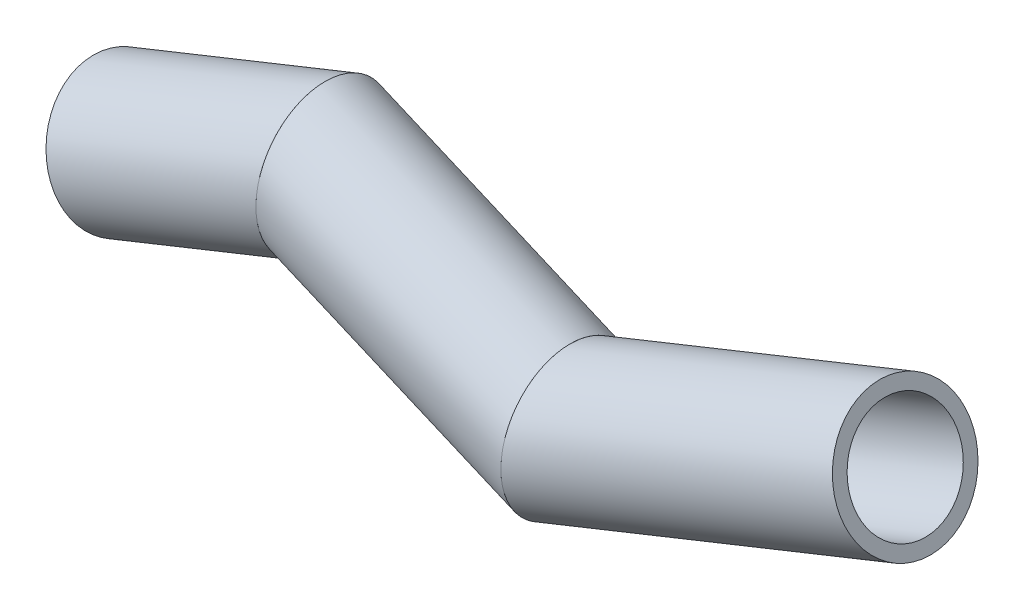
from build123d import *

# Parameters (mm, degrees)
SKETCH13_R                = 16.7005
SKETCH13_R_2              = 13.3223
PIPE_1_0_SCH_40_1_DEPTH   = 64.918382842
SKETCH13_ON_SEGMENT_2_R   = 16.7005
SKETCH13_ON_SEGMENT_2_R_2 = 13.3223
PIPE_1_0_SCH_40_1_2_DEPTH = 86.766827232
SKETCH13_ON_SEGMENT_3_R   = 16.7005
SKETCH13_ON_SEGMENT_3_R_2 = 13.3223
PIPE_1_0_SCH_40_1_3_DEPTH = 99.381160234


with BuildPart() as part:
    # Sketch13 → Pipe 1.0 SCH 40(1) (new body)
    with BuildSketch(Plane(origin=(-71.923098294, -13.905132337, 0), x_dir=(-0.3720014357764754, 0.9282321540327296, 0), z_dir=(0.9282321540327296, 0.3720014357764754, 0))):
        Circle(SKETCH13_R)
        Circle(SKETCH13_R_2, mode=Mode.SUBTRACT)
    extrude(amount=PIPE_1_0_SCH_40_1_DEPTH)

    # Pipe 1.0 SCH 40(1) mitre 1
    split(bisect_by=Plane(origin=(-21.672826953, 6.233335185, 0), x_dir=(-0.011534554, -0.999933475, 0), z_dir=(-0.999933475, 0.011534554, 0)), keep=Keep.TOP)


with BuildPart() as body_2:
    # Sketch13 on segment 2 (carried to segment 2) → Pipe 1.0 SCH 40_1 2 (new body)
    with BuildSketch(Plane(origin=(-31.586692494, 10.47441663, 0), x_dir=(0.393314513, 0.919403988, 0), z_dir=(0.919403988, -0.393314513, 0))):
        Circle(SKETCH13_ON_SEGMENT_2_R)
        Circle(SKETCH13_ON_SEGMENT_2_R_2, mode=Mode.SUBTRACT)
    extrude(amount=PIPE_1_0_SCH_40_1_2_DEPTH)

    # Pipe 1.0 SCH 40_1 2 mitre 1
    split(bisect_by=Plane(origin=(-21.672826953, 6.233335185, 0), x_dir=(0.011534554, 0.999933475, 0), z_dir=(0.999933475, -0.011534554, 0)), keep=Keep.TOP)

    # Pipe 1.0 SCH 40_1 2 mitre 2
    split(bisect_by=Plane(origin=(38.27320899, -19.411154305, 0), x_dir=(-0.011534554, -0.999933475, 0), z_dir=(-0.999933475, 0.011534554, 0)), keep=Keep.TOP)


with BuildPart() as body_3:
    # Sketch13 on segment 3 (carried to segment 3) → Pipe 1.0 SCH 40_1 3 (new body)
    with BuildSketch(Plane(origin=(28.26414999, -23.422418408, 0), x_dir=(-0.372001436, 0.928232154, 0), z_dir=(0.928232154, 0.372001436, 0))):
        Circle(SKETCH13_ON_SEGMENT_3_R)
        Circle(SKETCH13_ON_SEGMENT_3_R_2, mode=Mode.SUBTRACT)
    extrude(amount=PIPE_1_0_SCH_40_1_3_DEPTH)

    # Pipe 1.0 SCH 40_1 3 mitre 1
    split(bisect_by=Plane(origin=(38.27320899, -19.411154305, 0), x_dir=(0.011534554, 0.999933475, 0), z_dir=(0.999933475, -0.011534554, 0)), keep=Keep.TOP)


solid = Compound([part.part, body_2.part, body_3.part])
